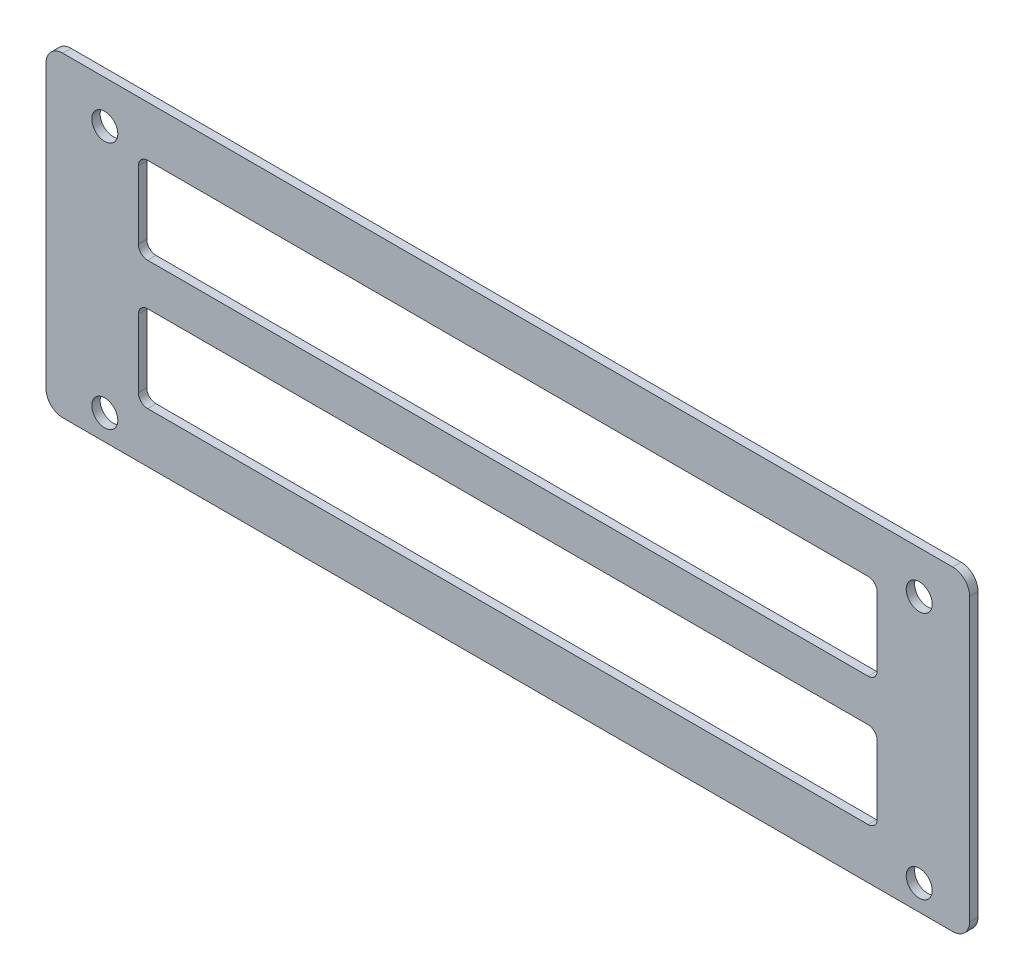
from build123d import *

# Parameters (mm, degrees)
SKETCH_1_W          = 110
SKETCH_1_H          = 37.6
EXTRUDE_1_DEPTH     = 1
SKETCH_2_R          = 1.55
CUT_EXTRUDE_1_DEPTH = 10
FILLET_1_R          = 2
SKETCH_3_W          = 57.499999899
SKETCH_3_H          = 18
CUT_EXTRUDE_2_DEPTH = 10
SKETCH_4_W          = 2
SKETCH_4_H          = 18
EXTRUDE_2_DEPTH     = 1
FILLET_2_R          = 1.5
SKETCH_5_W          = 88
SKETCH_5_H          = 25.6
CUT_EXTRUDE_3_DEPTH = 10
SKETCH_6_W          = 88
SKETCH_6_H          = 5
EXTRUDE_3_DEPTH     = 1
FILLET_3_R          = 1.1


with BuildPart() as part:
    # 草图1 → 凸台-拉伸1 (new body)
    with BuildSketch(Plane.XY):
        Rectangle(SKETCH_1_W, SKETCH_1_H)
    extrude(amount=EXTRUDE_1_DEPTH)

    # 草图2 → 切除-拉伸1 (cut)
    with BuildSketch(Plane(origin=(0, 0, 0), x_dir=(-1, 0, 0), z_dir=(0, 0, -1))):
        with Locations((48, 13.75)):
            Circle(SKETCH_2_R)
        with Locations((48, -15.8)):
            Circle(SKETCH_2_R)
        with Locations((-49, -15.8)):
            Circle(SKETCH_2_R)
        with Locations((-49, 13.75)):
            Circle(SKETCH_2_R)
    extrude(amount=-CUT_EXTRUDE_1_DEPTH, mode=Mode.SUBTRACT)

    # 圆角1
    fillet_1_edges = [part.edges().sort_by_distance(p)[0] for p in [
        (55, -18.8, 0.5),
        (-55, -18.8, 0.5),
        (-55, 18.8, 0.5),
        (55, 18.8, 0.5),
    ]]
    fillet(fillet_1_edges, radius=FILLET_1_R)

    # 草图3 → 切除-拉伸2 (cut)
    with BuildSketch(Plane(origin=(0, 0, 0), x_dir=(-1, 0, 0), z_dir=(0, 0, -1))):
        with Locations((9.655484107, -3.8)):
            Rectangle(SKETCH_3_W, SKETCH_3_H)
    extrude(amount=-CUT_EXTRUDE_2_DEPTH, mode=Mode.SUBTRACT)

    # 草图4 → 凸台-拉伸2 (add)
    with BuildSketch(Plane(origin=(0, 0, 0), x_dir=(-1, 0, 0), z_dir=(0, 0, -1))):
        with Locations((-10.094515843, -3.8)):
            Rectangle(SKETCH_4_W, SKETCH_4_H)
        with Locations((-0.094515843, -3.8)):
            Rectangle(SKETCH_4_W, SKETCH_4_H)
        with Locations((9.905484157, -3.8)):
            Rectangle(SKETCH_4_W, SKETCH_4_H)
        with Locations((19.905484157, -3.8)):
            Rectangle(SKETCH_4_W, SKETCH_4_H)
        with Locations((29.905484157, -3.8)):
            Rectangle(SKETCH_4_W, SKETCH_4_H)
    extrude(amount=-EXTRUDE_2_DEPTH)

    # 圆角2
    fillet_2_edges = [part.edges().sort_by_distance(p)[0] for p in [
        (-8.905484157, -12.8, 0.5),
        (-8.905484157, 5.2, 0.5),
        (-10.905484157, 5.2, 0.5),
        (-10.905484157, -12.8, 0.5),
        (-18.905484157, -12.8, 0.5),
        (-18.905484157, 5.2, 0.5),
        (-20.905484157, 5.2, 0.5),
        (-20.905484157, -12.8, 0.5),
        (-28.905484157, -12.8, 0.5),
        (-28.905484157, 5.2, 0.5),
        (-30.905484157, 5.2, 0.5),
        (-30.905484157, -12.8, 0.5),
        (-38.405484056, 5.2, 0.5),
        (-38.405484056, -12.8, 0.5),
        (19.094515843, -12.8, 0.5),
        (19.094515843, 5.2, 0.5),
        (11.094515843, 5.2, 0.5),
        (9.094515843, 5.2, 0.5),
        (9.094515843, -12.8, 0.5),
        (11.094515843, -12.8, 0.5),
        (1.094515843, -12.8, 0.5),
        (1.094515843, 5.2, 0.5),
        (-0.905484157, 5.2, 0.5),
        (-0.905484157, -12.8, 0.5),
    ]]
    fillet(fillet_2_edges, radius=FILLET_2_R)

    # 草图5 → 切除-拉伸3 (cut)
    with BuildSketch(Plane.XY.offset(1)):
        Rectangle(SKETCH_5_W, SKETCH_5_H)
    extrude(amount=-CUT_EXTRUDE_3_DEPTH, mode=Mode.SUBTRACT)

    # 草图6 → 凸台-拉伸3 (add)
    with BuildSketch(Plane.XY.offset(1)):
        Rectangle(SKETCH_6_W, SKETCH_6_H)
    extrude(amount=-EXTRUDE_3_DEPTH)

    # 圆角3
    fillet_3_edges = [part.edges().sort_by_distance(p)[0] for p in [
        (44, -12.8, 0.5),
        (44, 12.8, 0.5),
        (-44, -12.8, 0.5),
        (-44, 12.8, 0.5),
        (-44, 2.5, 0.5),
        (-44, -2.5, 0.5),
        (44, -2.5, 0.5),
        (44, 2.5, 0.5),
    ]]
    fillet(fillet_3_edges, radius=FILLET_3_R)


solid = part.part
